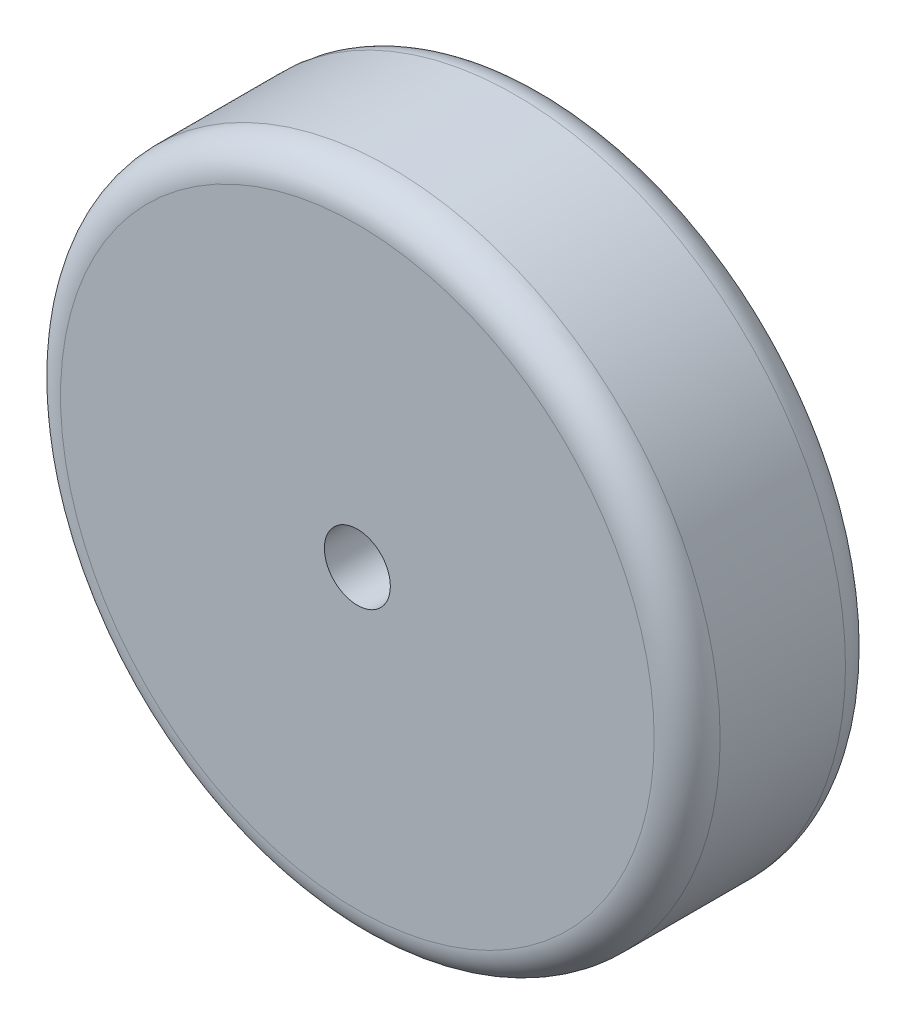
from build123d import *

# Parameters (mm, degrees)
SKETCH_1_R          = 50
EXTRUDE_1_DEPTH     = 29
SKETCH_2_R          = 5
CUT_EXTRUDE_1_DEPTH = 77.426435217
FILLET_1_R          = 5


with BuildPart() as part:
    # 草图1 → 凸台-拉伸1 (new body)
    with BuildSketch(Plane.XY):
        with Locations(Location((0, 0, 0), (0, 0, 180))):
            Circle(SKETCH_1_R)
    extrude(amount=EXTRUDE_1_DEPTH)

    # 草图2 → 切除-拉伸1 (cut, through all)
    with BuildSketch(Plane.XY.offset(29)):
        Circle(SKETCH_2_R)
    extrude(amount=-CUT_EXTRUDE_1_DEPTH, mode=Mode.SUBTRACT)

    # 圆角1
    fillet_1_edges = [part.edges().sort_by_distance(p)[0] for p in [
        (50, 0, 0),
        (50, 0, 29),
    ]]
    fillet(fillet_1_edges, radius=FILLET_1_R)


solid = part.part
